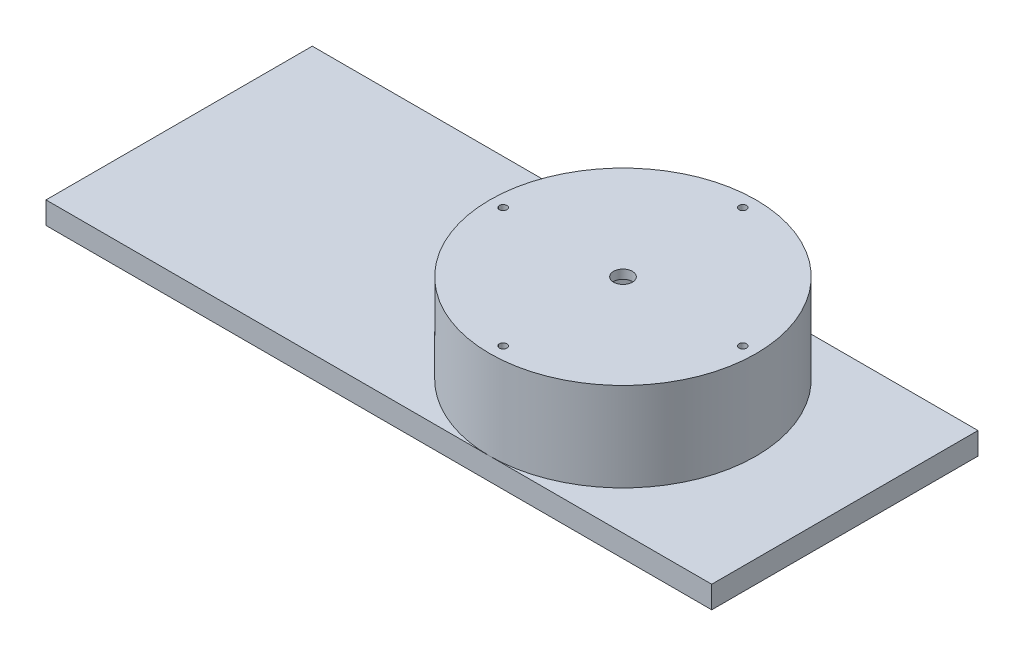
from build123d import *

# Parameters (mm, degrees)
SCHIZZO1_W                   = 300
SCHIZZO1_H                   = 120
ESTRUSIONE_ESTRUSIONE1_DEPTH = 10
SCHIZZO4_R                   = 60
ESTRUSIONE_ESTRUSIONE2_DEPTH = 40
SCHIZZO5_R                   = 48
TAGLIO_ESTRUSIONE1_DEPTH     = 46
SCHIZZO6_R                   = 4.25
TAGLIO_ESTRUSIONE2_DEPTH     = 46
SCHIZZO7_W                   = 20
SCHIZZO7_H                   = 2
TAGLIO_ESTRUSIONE3_DEPTH     = 46
FORO_PER_VITE_M3_1_D         = 3.4
FORO_PER_VITE_M3_1_DEPTH     = 5
FORO_PER_VITE_M3_1_TIP       = 1.021463052


with BuildPart() as part:
    # Schizzo1 → Estrusione-Estrusione1 (new body)
    with BuildSketch(Plane(origin=(0, 0, 0), x_dir=(1, 0, 0), z_dir=(0, 1, 0))):
        with Locations((-150, 60)):
            Rectangle(SCHIZZO1_W, SCHIZZO1_H)
    extrude(amount=ESTRUSIONE_ESTRUSIONE1_DEPTH)

    # Schizzo4 → Estrusione-Estrusione2 (add)
    with BuildSketch(Plane(origin=(0, 10, 0), x_dir=(1, 0, 0), z_dir=(0, 1, 0))):
        with Locations(Location((-100, 60, 0), (0, 0, 270))):
            Circle(SCHIZZO4_R)
    extrude(amount=ESTRUSIONE_ESTRUSIONE2_DEPTH)

    # Schizzo5 → Taglio-Estrusione1 (cut)
    with BuildSketch(Plane.XZ):
        with Locations(Location((-100, -60, 0), (0, 0, 270))):
            Circle(SCHIZZO5_R)
    extrude(amount=-TAGLIO_ESTRUSIONE1_DEPTH, mode=Mode.SUBTRACT)

    # Schizzo6 → Taglio-Estrusione2 (cut)
    with BuildSketch(Plane.XZ.offset(-46)):
        with Locations(Location((-100, -60, 0), (0, 0, 270))):
            Circle(SCHIZZO6_R)
    extrude(amount=-TAGLIO_ESTRUSIONE2_DEPTH, mode=Mode.SUBTRACT)

    # Schizzo7 → Taglio-Estrusione3 (cut)
    with BuildSketch(Plane.ZY.offset(160)):
        with Locations((-60, 11)):
            Rectangle(SCHIZZO7_W, SCHIZZO7_H)
    extrude(amount=-TAGLIO_ESTRUSIONE3_DEPTH, mode=Mode.SUBTRACT)

    # Foro per Vite M3-1
    with Locations(Plane(origin=(0, 50, 0), x_dir=(1, 0, 0), z_dir=(0, 1, 0))):
        with Locations((-154, 60), (-100, 114), (-46, 60), (-100, 6)):
            Hole(FORO_PER_VITE_M3_1_D / 2, depth=FORO_PER_VITE_M3_1_DEPTH)
            with Locations((0, 0, -(FORO_PER_VITE_M3_1_DEPTH + FORO_PER_VITE_M3_1_TIP / 2))):  # 118° drill point
                Cone(0, FORO_PER_VITE_M3_1_D / 2, FORO_PER_VITE_M3_1_TIP, mode=Mode.SUBTRACT)


solid = part.part
